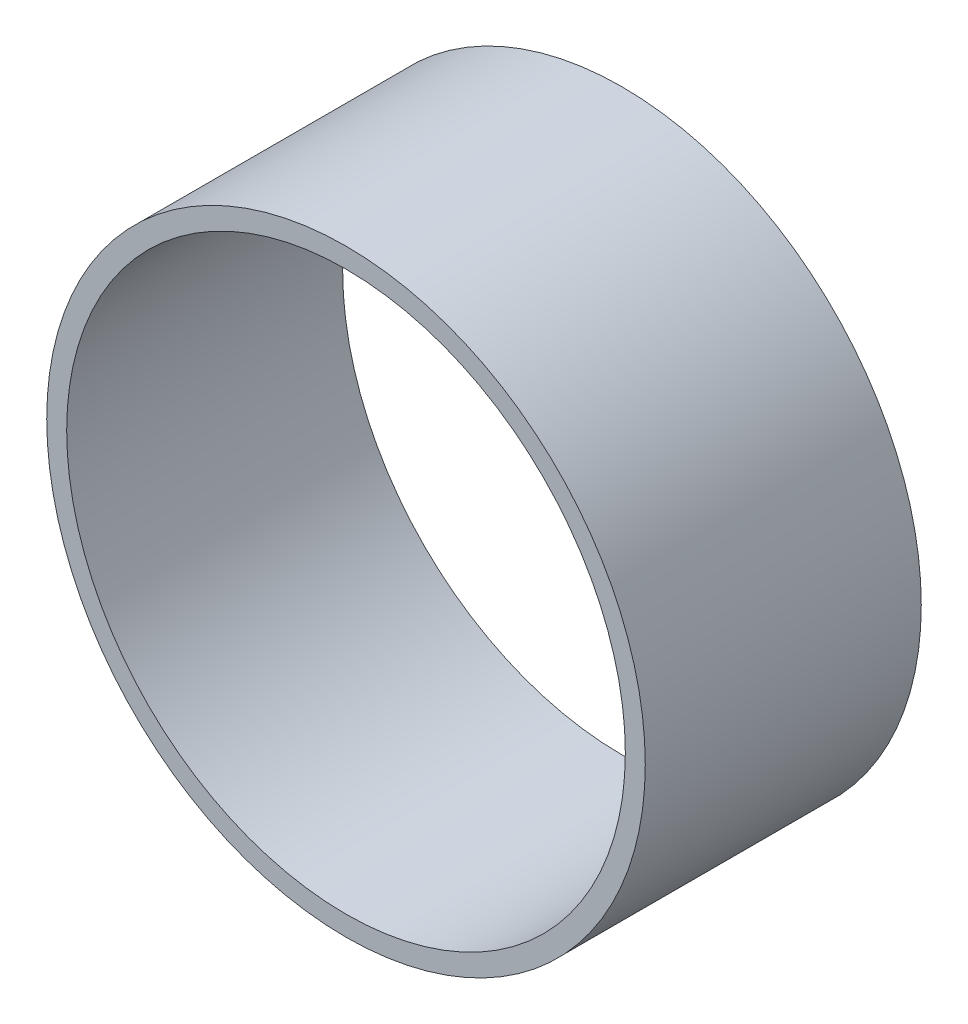
from build123d import *

# Parameters (mm, degrees)
SKETCH1_R           = 90
BOSS_EXTRUDE1_DEPTH = 83
SKETCH2_R           = 84
CUT_EXTRUDE1_DEPTH  = 103


with BuildPart() as part:
    # Sketch1 → Boss-Extrude1 (new body)
    with BuildSketch(Plane.XY.offset(30)):
        with Locations((300, 300)):
            Circle(SKETCH1_R)
    extrude(amount=BOSS_EXTRUDE1_DEPTH)

    # Sketch2 → Cut-Extrude1 (cut)
    with BuildSketch(Plane.XY.offset(113)):
        with Locations((300, 300)):
            Circle(SKETCH2_R)
    extrude(amount=-CUT_EXTRUDE1_DEPTH, mode=Mode.SUBTRACT)


solid = part.part
